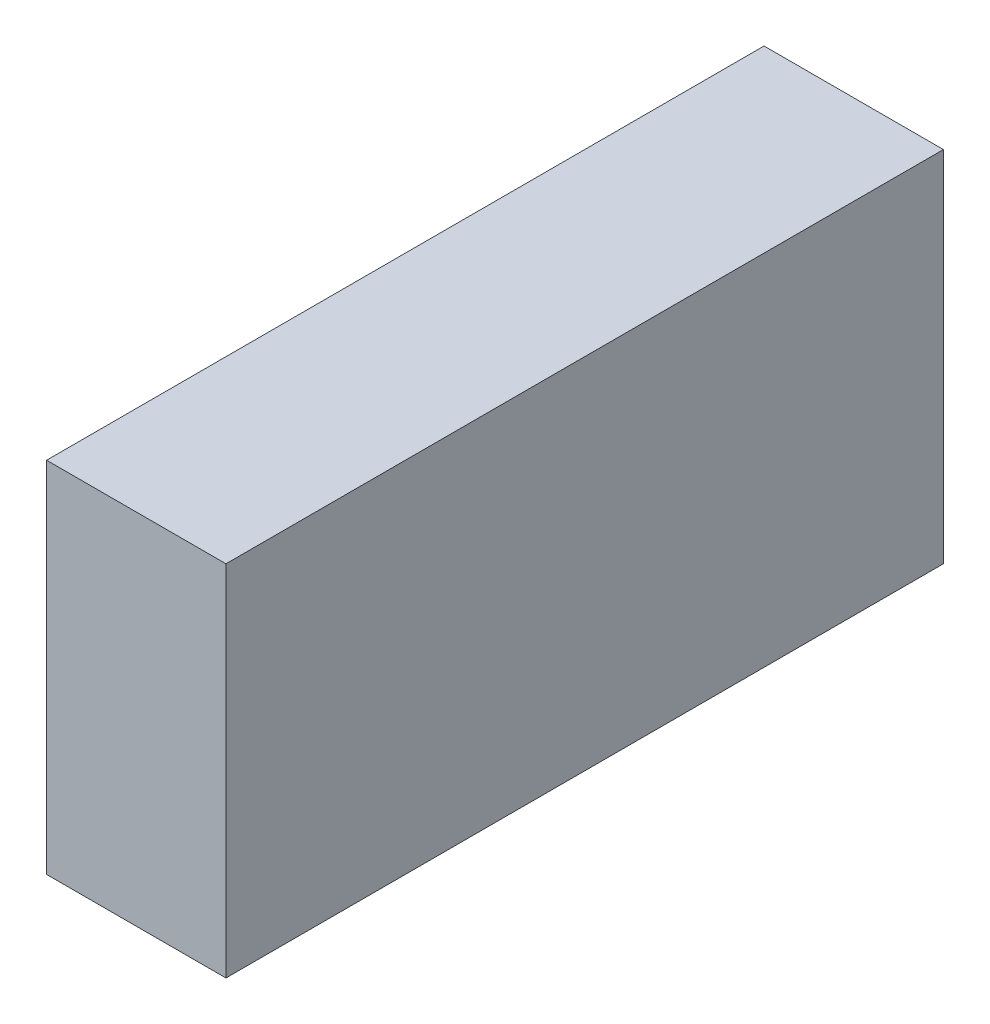
from build123d import *

# Parameters (mm, degrees)
SKETCH_1_W      = 10
SKETCH_1_H      = 20
EXTRUDE_1_DEPTH = 40


with BuildPart() as part:
    # ｽｹｯﾁ1 → 押し出し1 (new body)
    with BuildSketch(Plane.XY):
        with Locations((5, 10)):
            Rectangle(SKETCH_1_W, SKETCH_1_H)
    extrude(amount=EXTRUDE_1_DEPTH)


solid = part.part
